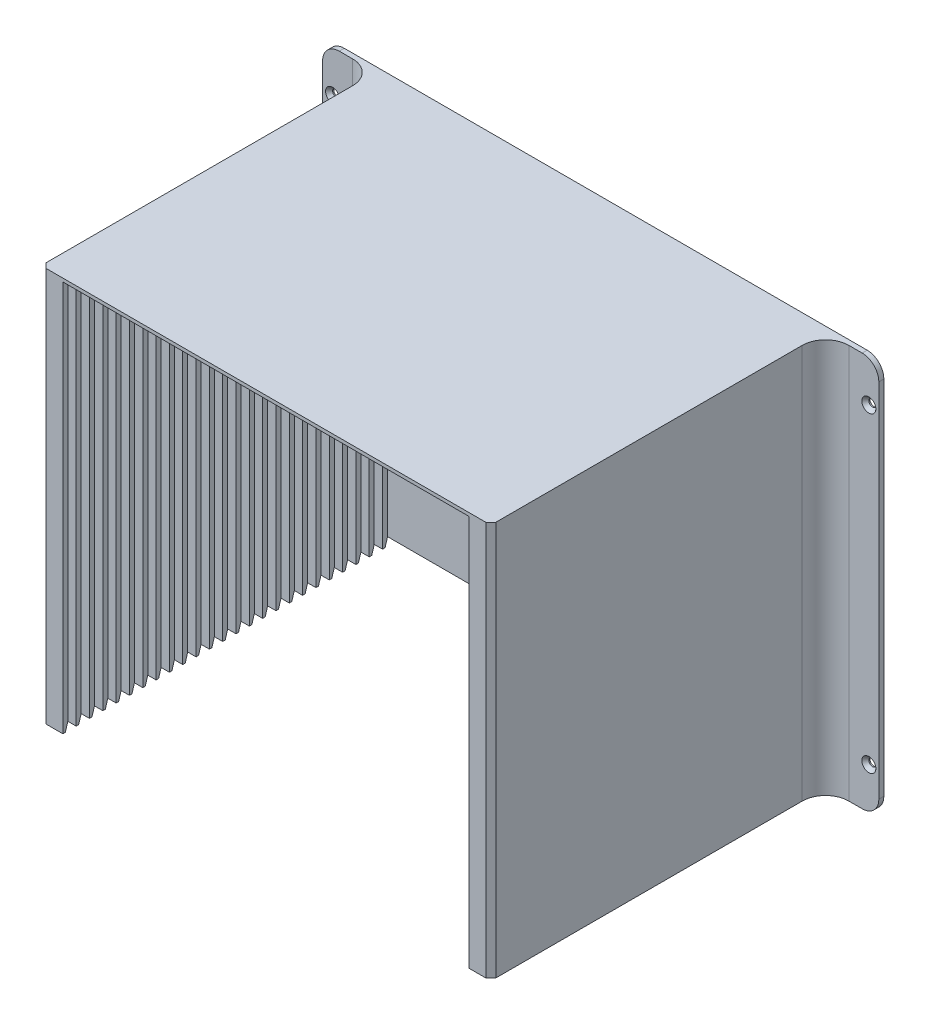
from build123d import *

# Parameters (mm, degrees)
SKETCH1_W                                     = 270
SKETCH1_H                                     = 4
BOSS_EXTRUDE1_DEPTH                           = 235
BOSS_EXTRUDE2_DEPTH                           = 235
CHAMFER1_SIZE                                 = 5
CHAMFER1_SIZE2                                = 1.5
LPATTERN1_COUNT                               = 25
LPATTERN1_PITCH                               = 8
SKETCH3_W                                     = 270
SKETCH3_H                                     = 204
BOSS_EXTRUDE3_DEPTH                           = 2
SKETCH4_W                                     = 32
SKETCH4_H                                     = 237
BOSS_EXTRUDE4_DEPTH                           = 3
CSK_FOR_8_FLAT_HEAD_MACHINE_SCREW1_AT_2_COUNT = 2
CSK_FOR_8_FLAT_HEAD_MACHINE_SCREW1_AT_2_PITCH = 187
FILLET1_R                                     = 10
FILLET2_R                                     = 14
CHAMFER2_SIZE                                 = 3


with BuildPart() as part:
    # Sketch1 → Boss-Extrude1 (new body)
    with BuildSketch(Plane(origin=(0, 0, 0), x_dir=(1, 0, 0), z_dir=(0, 1, 0))):
        with Locations((0, 2)):
            Rectangle(SKETCH1_W, SKETCH1_H)
    extrude(amount=BOSS_EXTRUDE1_DEPTH)



with BuildPart() as body_2:
    # Sketch2 → Boss-Extrude2 (new body)
    with BuildSketch(Plane.XZ):
        Polygon((135, 0), (135, 8), (122, 8), (122, 5), (130, 5), (130, 0), align=None)
    extrude(amount=-BOSS_EXTRUDE2_DEPTH)

    # Chamfer1
    chamfer1_edges = [body_2.edges().sort_by_distance(p)[0] for p in [
        (126, 0, 5),
    ]]
    chamfer1_side = [body_2.faces().sort_by_distance(p)[0] for p in [
        (126, 117.5, 5),
    ]]
    chamfer(chamfer1_edges, length=CHAMFER1_SIZE, length2=CHAMFER1_SIZE2, reference=chamfer1_side[0])


with BuildPart() as lpattern1_1:
    # LPattern1: pattern copy
    add(body_2.part.moved(Location(Vector(0, 0, 1) * (1 * LPATTERN1_PITCH))))


with BuildPart() as lpattern1_2:
    # LPattern1: pattern copy
    add(body_2.part.moved(Location(Vector(0, 0, 1) * (2 * LPATTERN1_PITCH))))


with BuildPart() as lpattern1_3:
    # LPattern1: pattern copy
    add(body_2.part.moved(Location(Vector(0, 0, 1) * (3 * LPATTERN1_PITCH))))


with BuildPart() as lpattern1_4:
    # LPattern1: pattern copy
    add(body_2.part.moved(Location(Vector(0, 0, 1) * (4 * LPATTERN1_PITCH))))


with BuildPart() as lpattern1_5:
    # LPattern1: pattern copy
    add(body_2.part.moved(Location(Vector(0, 0, 1) * (5 * LPATTERN1_PITCH))))


with BuildPart() as lpattern1_6:
    # LPattern1: pattern copy
    add(body_2.part.moved(Location(Vector(0, 0, 1) * (6 * LPATTERN1_PITCH))))


with BuildPart() as lpattern1_7:
    # LPattern1: pattern copy
    add(body_2.part.moved(Location(Vector(0, 0, 1) * (7 * LPATTERN1_PITCH))))


with BuildPart() as lpattern1_8:
    # LPattern1: pattern copy
    add(body_2.part.moved(Location(Vector(0, 0, 1) * (8 * LPATTERN1_PITCH))))


with BuildPart() as lpattern1_9:
    # LPattern1: pattern copy
    add(body_2.part.moved(Location(Vector(0, 0, 1) * (9 * LPATTERN1_PITCH))))


with BuildPart() as lpattern1_10:
    # LPattern1: pattern copy
    add(body_2.part.moved(Location(Vector(0, 0, 1) * (10 * LPATTERN1_PITCH))))


with BuildPart() as lpattern1_11:
    # LPattern1: pattern copy
    add(body_2.part.moved(Location(Vector(0, 0, 1) * (11 * LPATTERN1_PITCH))))


with BuildPart() as lpattern1_12:
    # LPattern1: pattern copy
    add(body_2.part.moved(Location(Vector(0, 0, 1) * (12 * LPATTERN1_PITCH))))


with BuildPart() as lpattern1_13:
    # LPattern1: pattern copy
    add(body_2.part.moved(Location(Vector(0, 0, 1) * (13 * LPATTERN1_PITCH))))


with BuildPart() as lpattern1_14:
    # LPattern1: pattern copy
    add(body_2.part.moved(Location(Vector(0, 0, 1) * (14 * LPATTERN1_PITCH))))


with BuildPart() as lpattern1_15:
    # LPattern1: pattern copy
    add(body_2.part.moved(Location(Vector(0, 0, 1) * (15 * LPATTERN1_PITCH))))


with BuildPart() as lpattern1_16:
    # LPattern1: pattern copy
    add(body_2.part.moved(Location(Vector(0, 0, 1) * (16 * LPATTERN1_PITCH))))


with BuildPart() as lpattern1_17:
    # LPattern1: pattern copy
    add(body_2.part.moved(Location(Vector(0, 0, 1) * (17 * LPATTERN1_PITCH))))


with BuildPart() as lpattern1_18:
    # LPattern1: pattern copy
    add(body_2.part.moved(Location(Vector(0, 0, 1) * (18 * LPATTERN1_PITCH))))


with BuildPart() as lpattern1_19:
    # LPattern1: pattern copy
    add(body_2.part.moved(Location(Vector(0, 0, 1) * (19 * LPATTERN1_PITCH))))


with BuildPart() as lpattern1_20:
    # LPattern1: pattern copy
    add(body_2.part.moved(Location(Vector(0, 0, 1) * (20 * LPATTERN1_PITCH))))


with BuildPart() as lpattern1_21:
    # LPattern1: pattern copy
    add(body_2.part.moved(Location(Vector(0, 0, 1) * (21 * LPATTERN1_PITCH))))


with BuildPart() as lpattern1_22:
    # LPattern1: pattern copy
    add(body_2.part.moved(Location(Vector(0, 0, 1) * (22 * LPATTERN1_PITCH))))


with BuildPart() as lpattern1_23:
    # LPattern1: pattern copy
    add(body_2.part.moved(Location(Vector(0, 0, 1) * (23 * LPATTERN1_PITCH))))


with BuildPart() as lpattern1_24:
    # LPattern1: pattern copy
    add(body_2.part.moved(Location(Vector(0, 0, 1) * (24 * LPATTERN1_PITCH))))


with BuildPart() as body_2_1:
    add(body_2.part)

    # Combine1: union LPattern1_1, LPattern1_2, LPattern1_3, LPattern1_4, LPattern1_5, LPattern1_6, LPattern1_7, LPattern1_8, LPattern1_9, LPattern1_11, LPattern1_10, LPattern1_12, LPattern1_13, LPattern1_14, LPattern1_15, LPattern1_16, LPattern1_17, LPattern1_18, LPattern1_19, LPattern1_20, LPattern1_21, LPattern1_22, LPattern1_24, LPattern1_23
    add(lpattern1_1.part)
    add(lpattern1_2.part)
    add(lpattern1_3.part)
    add(lpattern1_4.part)
    add(lpattern1_5.part)
    add(lpattern1_6.part)
    add(lpattern1_7.part)
    add(lpattern1_8.part)
    add(lpattern1_9.part)
    add(lpattern1_11.part)
    add(lpattern1_10.part)
    add(lpattern1_12.part)
    add(lpattern1_13.part)
    add(lpattern1_14.part)
    add(lpattern1_15.part)
    add(lpattern1_16.part)
    add(lpattern1_17.part)
    add(lpattern1_18.part)
    add(lpattern1_19.part)
    add(lpattern1_20.part)
    add(lpattern1_21.part)
    add(lpattern1_22.part)
    add(lpattern1_24.part)
    add(lpattern1_23.part)


with BuildPart() as body_3:
    # Mirror1: mirrored copy
    add(body_2_1.part.mirror(Plane(origin=(0, 0, 0), x_dir=(0, 0, 1), z_dir=(1, 0, 0))))


with BuildPart() as part_1:
    add(part.part)

    add(body_2_1.part)  # Boss-Extrude3 merges body 2

    add(body_3.part)  # Boss-Extrude3 merges body 3
    # Sketch3 → Boss-Extrude3 (add)
    with BuildSketch(Plane(origin=(0, 235, 0), x_dir=(1, 0, 0), z_dir=(0, 1, 0))):
        with Locations((0, -98)):
            Rectangle(SKETCH3_W, SKETCH3_H)
    extrude(amount=BOSS_EXTRUDE3_DEPTH)


with BuildPart() as body_2_2:
    # Sketch4 → Boss-Extrude4 (new body)
    with BuildSketch(Plane(origin=(0, 0, -4), x_dir=(-1, 0, 0), z_dir=(0, 0, -1))):
        with Locations((-151, 118.5)):
            Rectangle(SKETCH4_W, SKETCH4_H)
    extrude(amount=-BOSS_EXTRUDE4_DEPTH)

    # Sketch6 → CSK for #8 Flat Head Machine Screw1 (revolve, cut)
    with BuildSketch(Plane(origin=(161, 212, -1), x_dir=(0, -1, 0), z_dir=(1, 0, 0))):
        Polygon((0, 0), (0, 3), (2.2479, 3), (2.2479, 2.26450021), (4.2164, 0), align=None)
    csk_for_8_flat_head_machine_screw1 = revolve(axis=Axis((161, 212, 5.35), (0, 0, -1)), mode=Mode.SUBTRACT)

    # CSK for #8 Flat Head Machine Screw1 at 2: CSK for #8 Flat Head Machine Screw1 ×2
    with Locations(*[(0, -i * CSK_FOR_8_FLAT_HEAD_MACHINE_SCREW1_AT_2_PITCH, 0) for i in range(1, CSK_FOR_8_FLAT_HEAD_MACHINE_SCREW1_AT_2_COUNT)]):
        add(csk_for_8_flat_head_machine_screw1, mode=Mode.SUBTRACT)

    # Fillet1
    fillet1_edges = [body_2_2.edges().sort_by_distance(p)[0] for p in [
        (167, 0, -2.5),
        (167, 237, -2.5),
    ]]
    fillet(fillet1_edges, radius=FILLET1_R)


with BuildPart() as body_3_2:
    # Mirror3: mirrored copy
    add(body_2_2.part.mirror(Plane(origin=(0, 0, 0), x_dir=(0, 0, 1), z_dir=(1, 0, 0))))

    # Combine2: union part, body 2 2
    add(part_1.part)
    add(body_2_2.part)

    # Fillet2
    fillet2_edges = [body_3_2.edges().sort_by_distance(p)[0] for p in [
        (-135, 118.5, -1),
        (135, 118.5, -1),
    ]]
    fillet(fillet2_edges, radius=FILLET2_R)

    # Chamfer2
    chamfer2_edges = [body_3_2.edges().sort_by_distance(p)[0] for p in [
        (135, 118.5, 200),
        (-135, 118.5, 200),
    ]]
    chamfer(chamfer2_edges, length=CHAMFER2_SIZE)


solid = body_3_2.part
